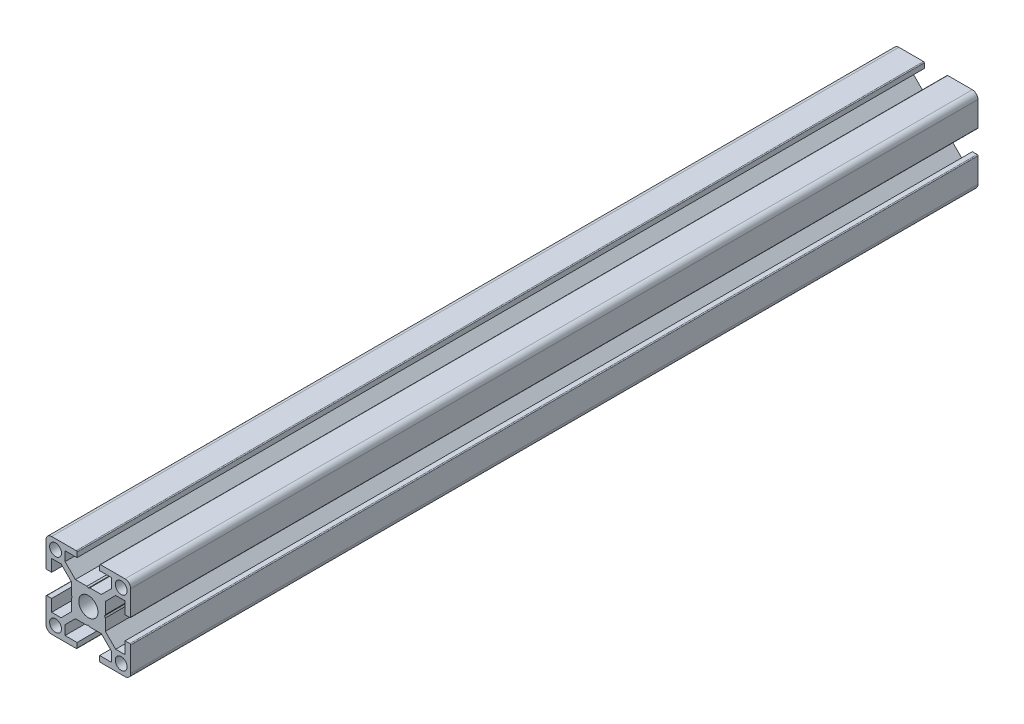
from build123d import *

# Parameters (mm, degrees)
SKETCH1_R           = 2.1
SKETCH1_R_2         = 3.4
BOSS_EXTRUDE1_DEPTH = 300


with BuildPart() as part:
    # Sketch1 → Boss-Extrude1 (new body)
    with BuildSketch(Plane.XY):
        with BuildLine():
            Line((-15, -4.3), (-15, -13))
            ThreePointArc((-15, -13), (-14.414213562, -14.414213562), (-13, -15))
            Line((-13, -15), (-4.3, -15))
            ThreePointArc((-4.3, -15), (-4.087867966, -14.912132034), (-4, -14.7))
            Line((-4, -14.7), (-4, -13))
            Line((-4, -13), (-8.249996, -13))
            Line((-8.249996, -13), (-8.249996, -9.664209562))
            Line((-8.249996, -9.664209562), (-4.585786438, -6))
            Line((-4.585786438, -6), (-0.519615242, -6))
            Line((-0.519615242, -6), (0, -5.7))
            Line((0, -5.7), (0.519615242, -6))
            Line((0.519615242, -6), (4.585786438, -6))
            Line((4.585786438, -6), (8.250004, -9.664217562))
            Line((8.250004, -9.664217562), (8.250004, -13))
            Line((8.250004, -13), (4, -13))
            Line((4, -13), (4, -14.7))
            ThreePointArc((4, -14.7), (4.087867966, -14.912132034), (4.3, -15))
            Line((4.3, -15), (13, -15))
            ThreePointArc((13, -15), (14.414213562, -14.414213562), (15, -13))
            Line((15, -13), (15, -4.3))
            ThreePointArc((15, -4.3), (14.912132034, -4.087867966), (14.7, -4))
            Line((14.7, -4), (13, -4))
            Line((13, -4), (13, -8.25))
            Line((13, -8.25), (9.664213562, -8.25))
            Line((9.664213562, -8.25), (6, -4.585786438))
            Line((6, -4.585786438), (6, -0.519615242))
            Line((6, -0.519615242), (5.7, 0))
            Line((5.7, 0), (6, 0.519615242))
            Line((6, 0.519615242), (6, 4.585786438))
            Line((6, 4.585786438), (9.664213562, 8.25))
            Line((9.664213562, 8.25), (13, 8.25))
            Line((13, 8.25), (13, 4))
            Line((13, 4), (14.7, 4))
            ThreePointArc((14.7, 4), (14.912132034, 4.087867966), (15, 4.3))
            Line((15, 4.3), (15, 13))
            ThreePointArc((15, 13), (14.414213562, 14.414213562), (13, 15))
            Line((13, 15), (4.3, 15))
            ThreePointArc((4.3, 15), (4.087867966, 14.912132034), (4, 14.7))
            Line((4, 14.7), (4, 13))
            Line((4, 13), (8.25, 13))
            Line((8.25, 13), (8.25, 9.664213562))
            Line((8.25, 9.664213562), (4.585786438, 6))
            Line((4.585786438, 6), (0.519615242, 6))
            Line((0.519615242, 6), (0, 5.7))
            Line((0, 5.7), (-0.519615242, 6))
            Line((-0.519615242, 6), (-4.585786438, 6))
            Line((-4.585786438, 6), (-8.25, 9.664213562))
            Line((-8.25, 9.664213562), (-8.25, 13))
            Line((-8.25, 13), (-4, 13))
            Line((-4, 13), (-4, 14.7))
            ThreePointArc((-4, 14.7), (-4.087867966, 14.912132034), (-4.3, 15))
            Line((-4.3, 15), (-13, 15))
            ThreePointArc((-13, 15), (-14.414213562, 14.414213562), (-15, 13))
            Line((-15, 13), (-15, 4.3))
            ThreePointArc((-15, 4.3), (-14.912132034, 4.087867966), (-14.7, 4))
            Line((-14.7, 4), (-13, 4))
            Line((-13, 4), (-13, 8.25))
            Line((-13, 8.25), (-9.664213562, 8.25))
            Line((-9.664213562, 8.25), (-6, 4.585786438))
            Line((-6, 4.585786438), (-6, 0.519615242))
            Line((-6, 0.519615242), (-5.7, 0))
            Line((-5.7, 0), (-6, -0.519615242))
            Line((-6, -0.519615242), (-6, -4.585786438))
            Line((-6, -4.585786438), (-9.664213562, -8.25))
            Line((-9.664213562, -8.25), (-13, -8.25))
            Line((-13, -8.25), (-13, -4))
            Line((-13, -4), (-14.7, -4))
            ThreePointArc((-14.7, -4), (-14.912132034, -4.087867966), (-15, -4.3))
        make_face()
        with Locations((11.625, -11.625)):
            Circle(SKETCH1_R, mode=Mode.SUBTRACT)
        with Locations((11.625, 11.625)):
            Circle(SKETCH1_R, mode=Mode.SUBTRACT)
        Circle(SKETCH1_R_2, mode=Mode.SUBTRACT)
        with Locations((-11.625, -11.625)):
            Circle(SKETCH1_R, mode=Mode.SUBTRACT)
        with Locations((-11.625, 11.625)):
            Circle(SKETCH1_R, mode=Mode.SUBTRACT)
    extrude(amount=-BOSS_EXTRUDE1_DEPTH)


solid = part.part
